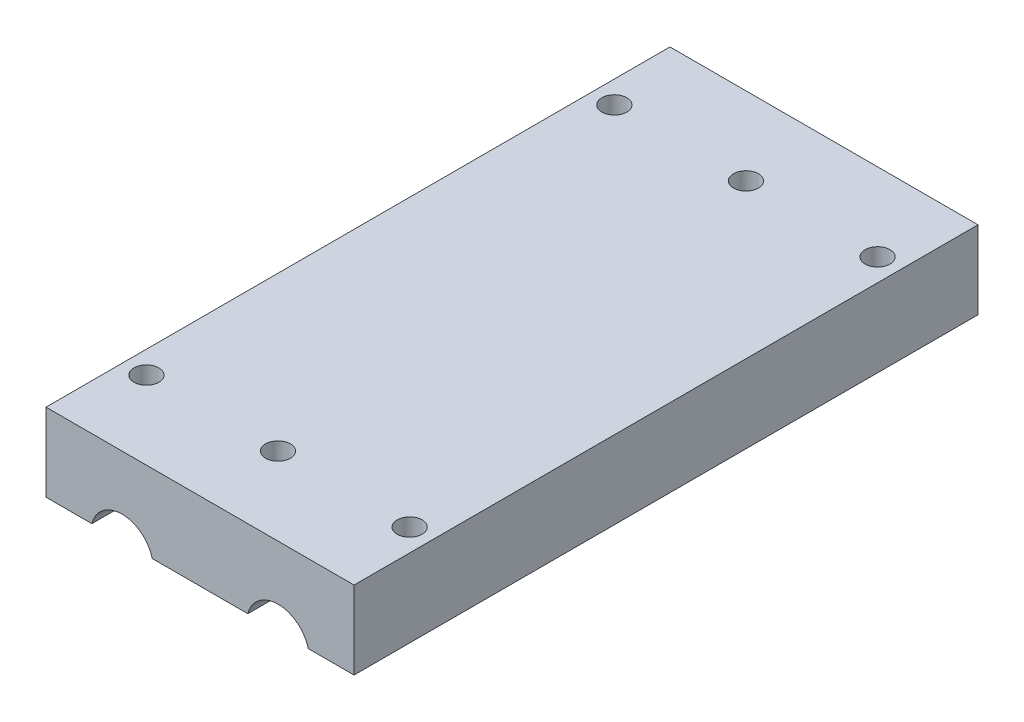
from build123d import *

# Parameters (mm, degrees)
CROQUIS1_W              = 39.5
CROQUIS1_H              = 80
SALIENTE_EXTRUIR1_DEPTH = 10
CROQUIS2_R              = 4
CORTAR_EXTRUIR1_DEPTH   = 82
CROQUIS3_R              = 1.6
CORTAR_EXTRUIR2_DEPTH   = 11


with BuildPart() as part:
    # Croquis1 → Saliente-Extruir1 (new body)
    with BuildSketch(Plane(origin=(0, 0, 0), x_dir=(1, 0, 0), z_dir=(0, 1, 0))):
        Rectangle(CROQUIS1_W, CROQUIS1_H)
    extrude(amount=SALIENTE_EXTRUIR1_DEPTH)

    # Croquis2 → Cortar-Extruir1 (cut)
    with BuildSketch(Plane.XY.offset(40)):
        with Locations((-10, -1)):
            Circle(CROQUIS2_R)
        with Locations((10, -1)):
            Circle(CROQUIS2_R)
    extrude(amount=-CORTAR_EXTRUIR1_DEPTH, mode=Mode.SUBTRACT)

    # Croquis3 → Cortar-Extruir2 (cut)
    with BuildSketch(Plane(origin=(0, 10, 0), x_dir=(1, 0, 0), z_dir=(0, 1, 0))):
        with Locations(Location((-16.875, 30, 0), (0, 0, 270))):
            Circle(CROQUIS3_R)
        with Locations(Location((0, 30, 0), (0, 0, 270))):
            Circle(CROQUIS3_R)
        with Locations(Location((16.875, 30, 0), (0, 0, 270))):
            Circle(CROQUIS3_R)
        with Locations(Location((-16.875, -30, 0), (0, 0, 270))):
            Circle(CROQUIS3_R)
        with Locations(Location((0, -30, 0), (0, 0, 270))):
            Circle(CROQUIS3_R)
        with Locations(Location((16.875, -30, 0), (0, 0, 270))):
            Circle(CROQUIS3_R)
    extrude(amount=-CORTAR_EXTRUIR2_DEPTH, mode=Mode.SUBTRACT)


solid = part.part
